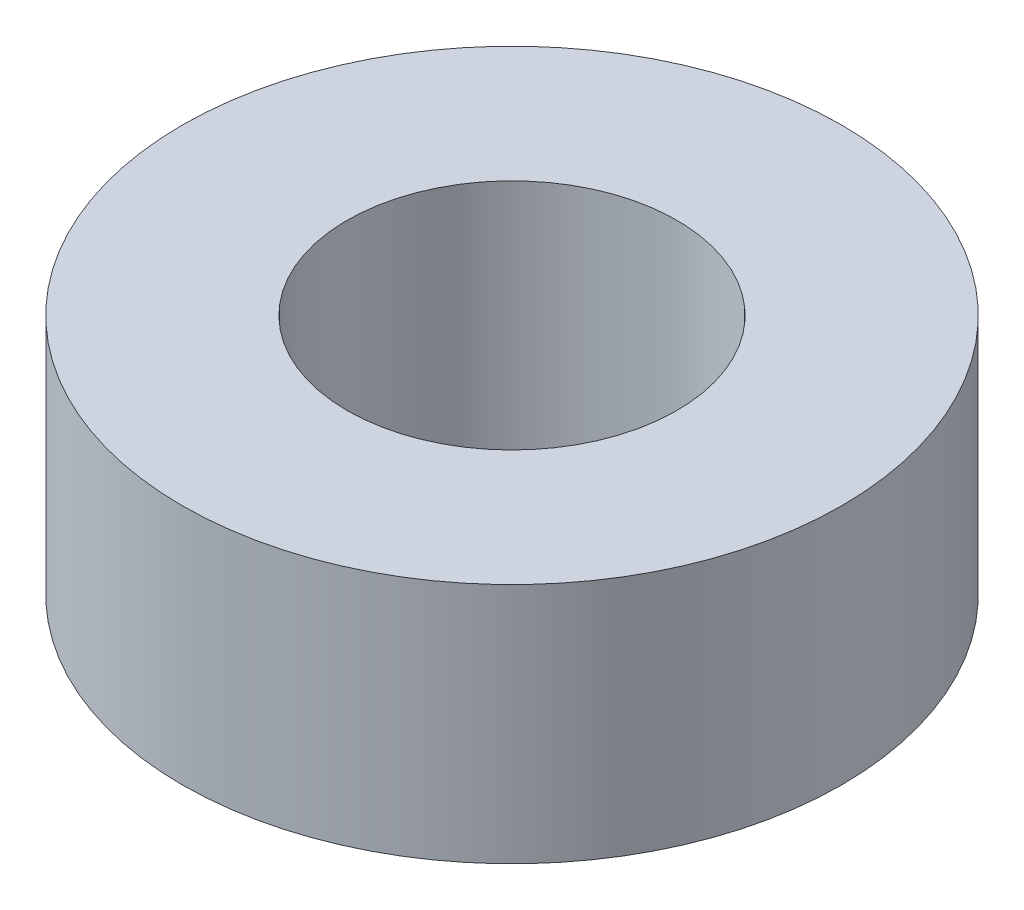
from build123d import *

# Parameters (mm, degrees)
SKETCH_1_R      = 3
SKETCH_1_R_2    = 1.5
EXTRUDE_1_DEPTH = 2.2


with BuildPart() as part:
    # 草图1 → 凸台-拉伸1 (new body)
    with BuildSketch(Plane(origin=(0, 0, 0), x_dir=(1, 0, 0), z_dir=(0, 1, 0))):
        with Locations(Location((0, 0, 0), (0, 0, 270))):
            Circle(SKETCH_1_R)
        with Locations(Location((0, 0, 0), (0, 0, 270))):
            Circle(SKETCH_1_R_2, mode=Mode.SUBTRACT)
    extrude(amount=EXTRUDE_1_DEPTH)


solid = part.part
